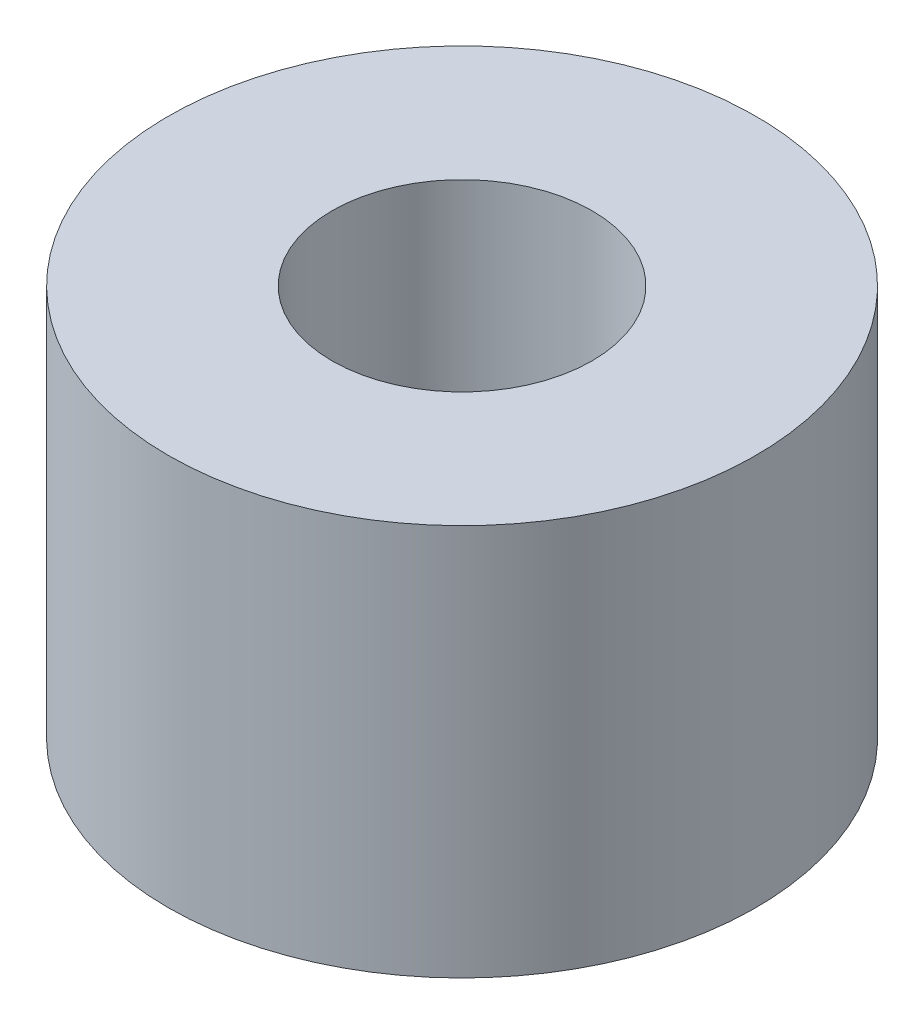
from build123d import *

# Parameters (mm, degrees)
SKETCH1_R           = 4.7625
SKETCH1_R_2         = 2.1082
BOSS_EXTRUDE1_DEPTH = 6.35


with BuildPart() as part:
    # Sketch1 → Boss-Extrude1 (new body)
    with BuildSketch(Plane(origin=(0, 0, 0), x_dir=(1, 0, 0), z_dir=(0, 1, 0))):
        with Locations(Location((0, 0, 0), (0, 0, 270))):
            Circle(SKETCH1_R)
        with Locations(Location((0, 0, 0), (0, 0, 270))):
            Circle(SKETCH1_R_2, mode=Mode.SUBTRACT)
    extrude(amount=BOSS_EXTRUDE1_DEPTH)


solid = part.part
